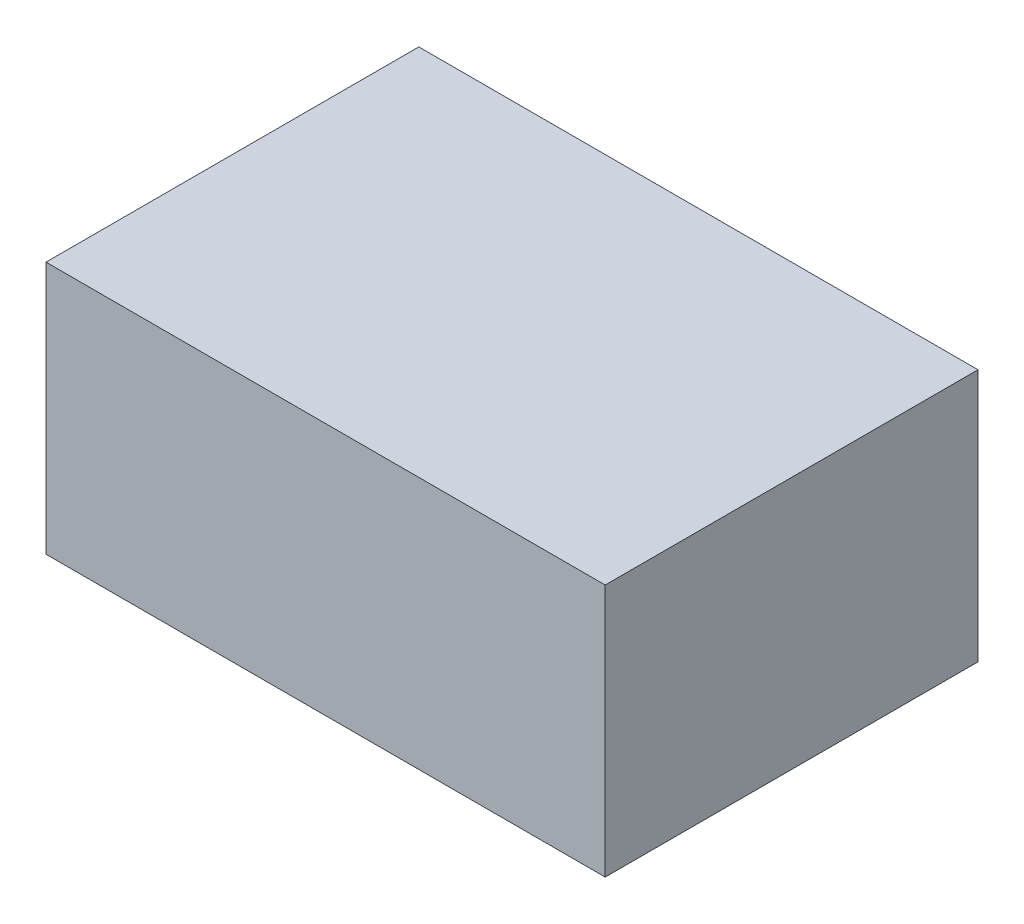
from build123d import *

# Parameters (mm, degrees)
SKETCH_1_W      = 4.2
SKETCH_1_H      = 2.8
EXTRUDE_1_DEPTH = 1.9


with BuildPart() as part:
    # Эскиз1 → Бобышка-Вытянуть1 (new body)
    with BuildSketch(Plane(origin=(0, 0, 0), x_dir=(1, 0, 0), z_dir=(0, 1, 0))):
        Rectangle(SKETCH_1_W, SKETCH_1_H)
    extrude(amount=EXTRUDE_1_DEPTH)


solid = part.part
